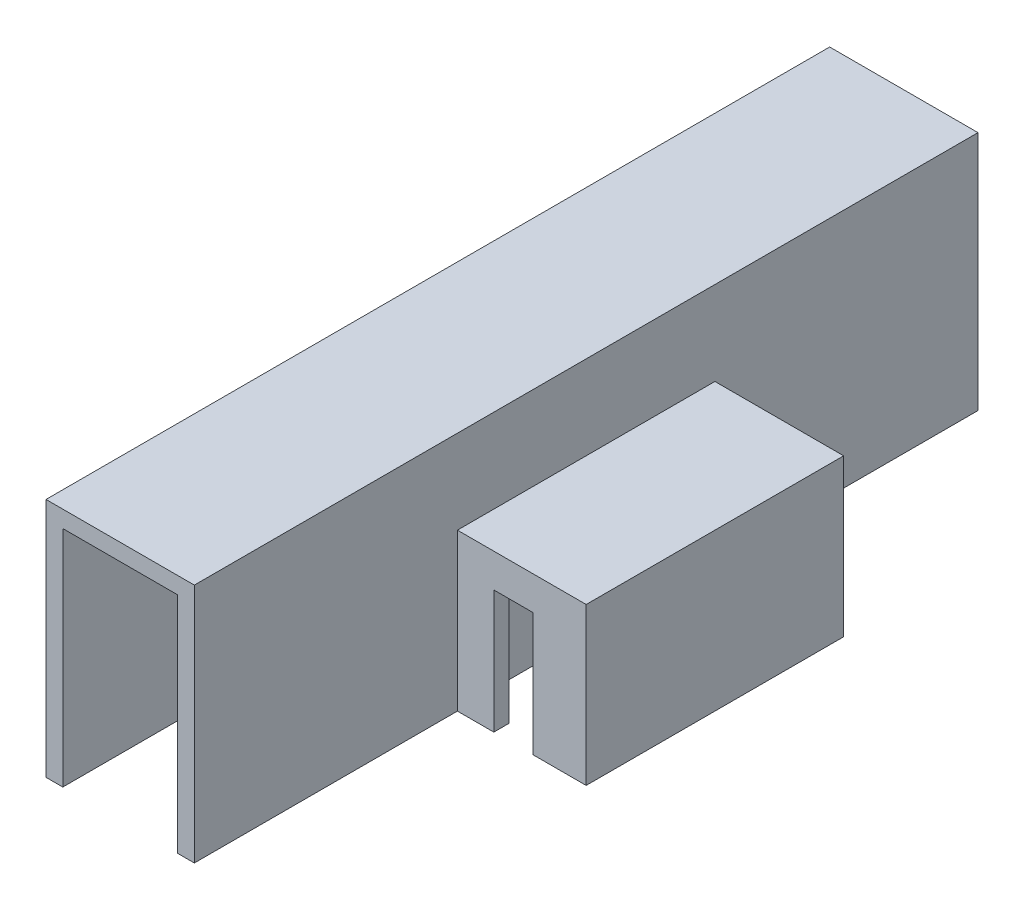
from build123d import *

# Parameters (mm, degrees)
SKETCH1_W            = 26
SKETCH1_H            = 46
SKETCH1_W_2          = 20.5
SKETCH1_H_2          = 40.5
BOSS_EXTRUDE1_DEPTH  = 26
SKETCH2_W            = 26
SKETCH2_H            = 46
BOSS_EXTRUDE2_DEPTH  = 2
SKETCH3_W            = 7
SKETCH3_H            = 3
CUT_EXTRUDE1_DEPTH   = 22
SKETCH6_W            = 3
SKETCH6_H            = 40
BOSS_EXTRUDE5_DEPTH  = 7
SKETCH7_W            = 3
SKETCH7_H            = 40
BOSS_EXTRUDE6_DEPTH  = 7
SKETCH8_W            = 46
SKETCH8_H            = 12
BOSS_EXTRUDE7_DEPTH  = 3
SKETCH10_W           = 23.5
SKETCH10_H           = 60
BOSS_EXTRUDE8_DEPTH  = 3
SKETCH11_W           = 60
SKETCH11_H           = 43
BOSS_EXTRUDE9_DEPTH  = 3
BOSS_EXTRUDE10_DEPTH = 40
BOSS_EXTRUDE11_DEPTH = 40


with BuildPart() as part:
    # Sketch1 → Boss-Extrude1 (new body)
    with BuildSketch(Plane(origin=(0, 0, 0), x_dir=(1, 0, 0), z_dir=(0, 1, 0))):
        Rectangle(SKETCH1_W, SKETCH1_H)
        Rectangle(SKETCH1_W_2, SKETCH1_H_2, mode=Mode.SUBTRACT)
    extrude(amount=BOSS_EXTRUDE1_DEPTH)

    # Sketch2 → Boss-Extrude2 (add)
    with BuildSketch(Plane(origin=(0, 26, 0), x_dir=(1, 0, 0), z_dir=(0, 1, 0))):
        Rectangle(SKETCH2_W, SKETCH2_H)
    extrude(amount=BOSS_EXTRUDE2_DEPTH)

    # Sketch3 → Cut-Extrude1 (cut)
    with BuildSketch(Plane.XZ):
        with Locations((0, 21.5)):
            Rectangle(SKETCH3_W, SKETCH3_H)
    extrude(amount=-CUT_EXTRUDE1_DEPTH, mode=Mode.SUBTRACT)

    # Sketch6 → Boss-Extrude5 (add)
    with BuildSketch(Plane.XY.offset(23)):
        with Locations((-11.5, 20)):
            Rectangle(SKETCH6_W, SKETCH6_H)
    extrude(amount=BOSS_EXTRUDE5_DEPTH)

    # Sketch7 → Boss-Extrude6 (add)
    with BuildSketch(Plane(origin=(0, 0, -23), x_dir=(-1, 0, 0), z_dir=(0, 0, -1))):
        with Locations((11.5, 20)):
            Rectangle(SKETCH7_W, SKETCH7_H)
    extrude(amount=BOSS_EXTRUDE6_DEPTH)

    # Sketch8 → Boss-Extrude7 (add)
    with BuildSketch(Plane(origin=(-10, 0, 0), x_dir=(0, 0, -1), z_dir=(1, 0, 0))):
        with Locations((0, 34)):
            Rectangle(SKETCH8_W, SKETCH8_H)
    extrude(amount=-BOSS_EXTRUDE7_DEPTH)

    # Sketch10 → Boss-Extrude8 (add)
    with BuildSketch(Plane(origin=(0, 40, 0), x_dir=(1, 0, 0), z_dir=(0, 1, 0))):
        with Locations((-21.75, 0)):
            Rectangle(SKETCH10_W, SKETCH10_H)
    extrude(amount=BOSS_EXTRUDE8_DEPTH)

    # Sketch11 → Boss-Extrude9 (add)
    with BuildSketch(Plane.ZY.offset(33.5)):
        with Locations((0, 21.5)):
            Rectangle(SKETCH11_W, SKETCH11_H)
    extrude(amount=BOSS_EXTRUDE9_DEPTH)

    # Sketch12 → Boss-Extrude10 (add)
    with BuildSketch(Plane.XY.offset(30)):
        Polygon((-33.5, 0), (-36.5, 0), (-36.5, 43), (-10, 43), (-10, 0), (-13, 0), (-13, 40), (-33.5, 40), align=None)
    extrude(amount=BOSS_EXTRUDE10_DEPTH)

    # Sketch13 → Boss-Extrude11 (add)
    with BuildSketch(Plane(origin=(0, 0, -30), x_dir=(-1, 0, 0), z_dir=(0, 0, -1))):
        Polygon((13, 0), (10, 0), (10, 43), (36.5, 43), (36.5, 0), (33.5, 0), (33.5, 40), (13, 40), align=None)
    extrude(amount=BOSS_EXTRUDE11_DEPTH)


solid = part.part
